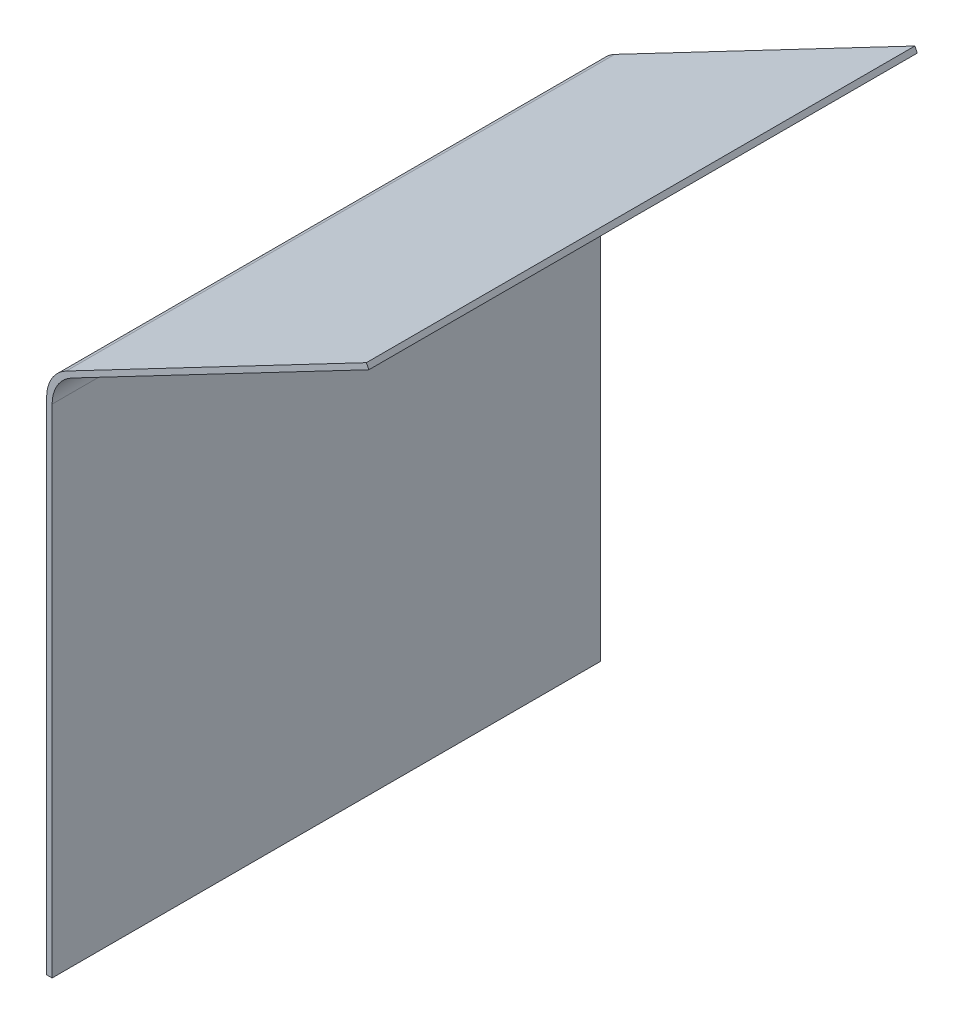
from build123d import *

# Parameters (mm, degrees)
BOSS_EXTRUDE1_DEPTH      = 280
BOSS_EXTRUDE1_DEPTH_BACK = 20


with BuildPart() as part:
    # Sketch1 → Boss-Extrude1 (new, two sides: drawn at the far end of the back side and taken through both)
    with BuildSketch(Plane.XY.offset(-BOSS_EXTRUDE1_DEPTH_BACK)):
        with BuildLine():
            Line((-170.37773053, -331.05), (-168.636, -331.05))
            Line((-168.636, -331.05), (-168.636, -59.198829312))
            ThreePointArc((-168.636, -59.198829312), (-165.748851618, -48.847485946), (-157.920969051, -41.484729004))
            Line((-157.920969051, -41.484729004), (-156.629100836, -40.807587282))
            Line((-156.629100836, -40.807587282), (-21.840950481, 29.842560493))
            Line((-21.840950481, 29.842560493), (4.633492495, 43.719324167))
            Line((4.633492495, 43.719324167), (3.240747138, 46.376439213))
            Line((3.240747138, 46.376439213), (-160.920969051, -39.670067673))
            ThreePointArc((-160.920969051, -39.670067673), (-168.748851618, -47.032824615), (-171.636, -57.384167981))
            Line((-171.636, -57.384167981), (-171.636, -331.05))
            Line((-171.636, -331.05), (-170.37773053, -331.05))
        make_face()
    extrude(amount=BOSS_EXTRUDE1_DEPTH + BOSS_EXTRUDE1_DEPTH_BACK)


solid = part.part
